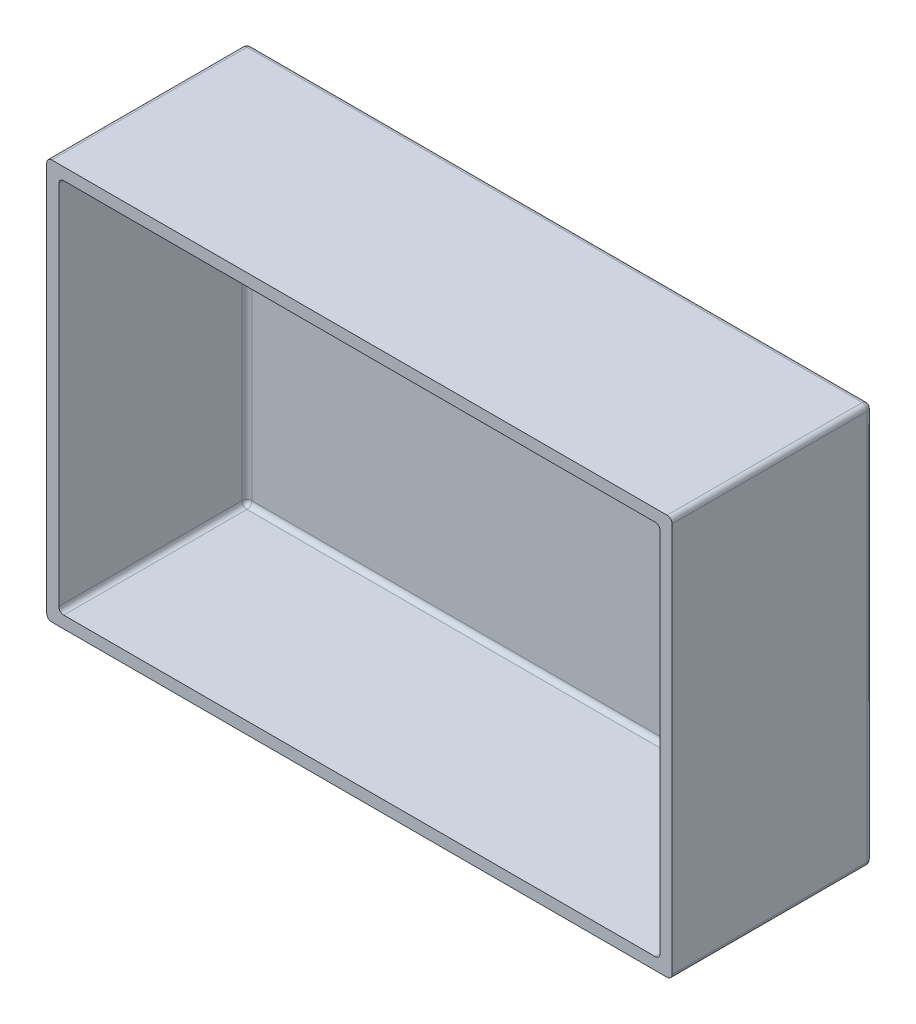
from build123d import *

# Parameters (mm, degrees)
SKETCH_1_W          = 125
SKETCH_1_H          = 80
EXTRUDE_1_DEPTH     = 40
SKETCH_2_W          = 120.2
SKETCH_2_H          = 75.2
CUT_EXTRUDE_1_DEPTH = 37.6
FILLET_1_R          = 1
FILLET_2_R          = 1


with BuildPart() as part:
    # Эскиз1 → Бобышка-Вытянуть1 (new body)
    with BuildSketch(Plane.XY):
        Rectangle(SKETCH_1_W, SKETCH_1_H)
    extrude(amount=EXTRUDE_1_DEPTH)

    # Эскиз2 → Вырез-Вытянуть1 (cut)
    with BuildSketch(Plane.XY.offset(40)):
        Rectangle(SKETCH_2_W, SKETCH_2_H)
    extrude(amount=-CUT_EXTRUDE_1_DEPTH, mode=Mode.SUBTRACT)

    # Скругление1
    fillet_1_edges = [part.edges().sort_by_distance(p)[0] for p in [
        (0, -40, 0),
        (-62.5, 0, 0),
        (0, 40, 0),
        (62.5, 0, 0),
        (62.5, -40, 20),
        (-62.5, -40, 20),
        (-62.5, 40, 20),
        (62.5, 40, 20),
    ]]
    fillet(fillet_1_edges, radius=FILLET_1_R)

    # Скругление2
    fillet_2_edges = [part.edges().sort_by_distance(p)[0] for p in [
        (60.1, 0, 2.4),
        (60.1, 37.6, 21.2),
        (0, -37.6, 2.4),
        (60.1, -37.6, 21.2),
        (-60.1, 0, 2.4),
        (-60.1, -37.6, 21.2),
        (0, 37.6, 2.4),
        (-60.1, 37.6, 21.2),
    ]]
    fillet(fillet_2_edges, radius=FILLET_2_R)


solid = part.part
